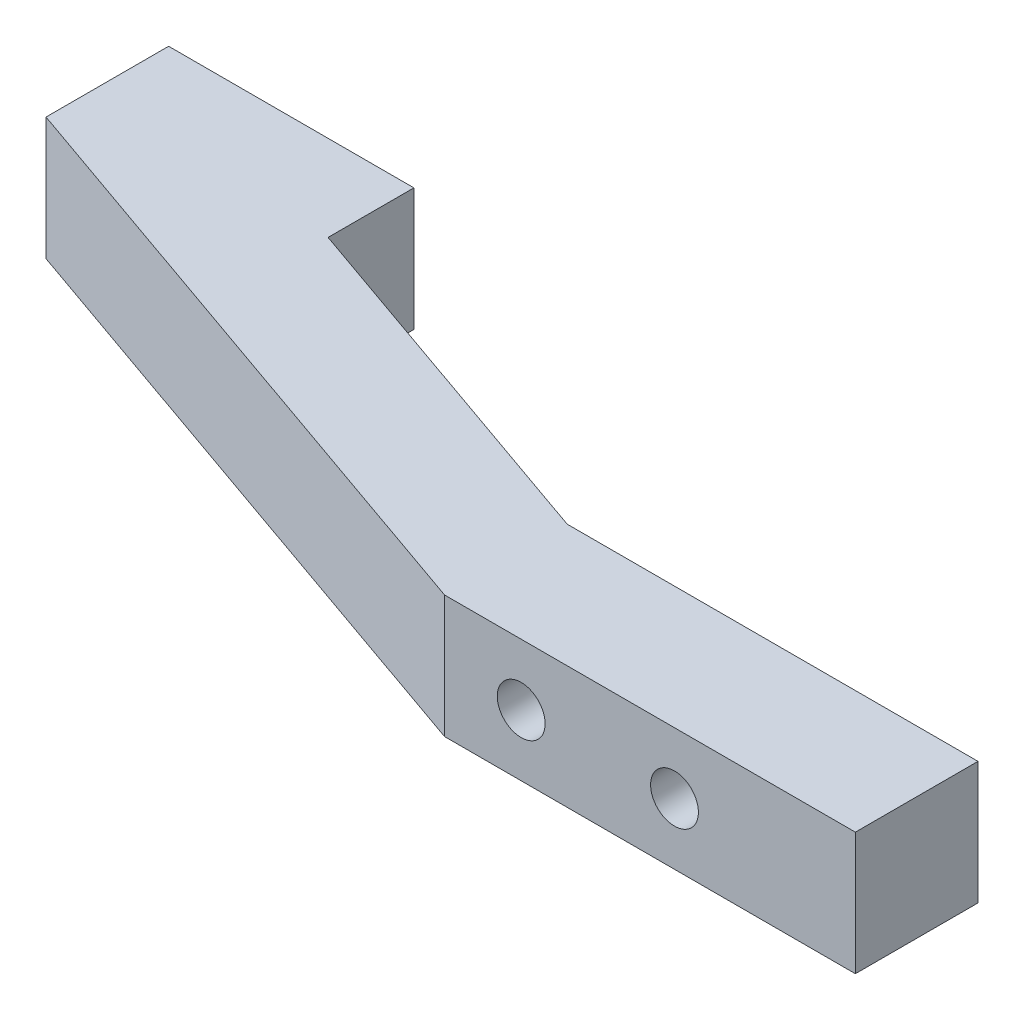
from build123d import *

# Parameters (mm, degrees)
SKETCH3_W           = 13.4
SKETCH3_H           = 4
SKETCH3_R           = 0.78
BOSS_EXTRUDE1_DEPTH = 4
BOSS_EXTRUDE2_DEPTH = 4
SKETCH5_W           = 8
SKETCH5_H           = 4
BOSS_EXTRUDE3_DEPTH = 1


with BuildPart() as part:
    # Sketch3 → Boss-Extrude1 (new body)
    with BuildSketch(Plane.XY):
        with Locations((6.7, 2)):
            Rectangle(SKETCH3_W, SKETCH3_H)
        with Locations((2.5, 2)):
            Circle(SKETCH3_R, mode=Mode.SUBTRACT)
        with Locations((7.5, 2)):
            Circle(SKETCH3_R, mode=Mode.SUBTRACT)
    extrude(amount=BOSS_EXTRUDE1_DEPTH)

    # Sketch4 → Boss-Extrude2 (add)
    with BuildSketch(Plane(origin=(0, 4, 0), x_dir=(1, 0, 0), z_dir=(0, 1, 0))):
        Polygon((0, -4), (-20, 3), (-20, 6), (-12, 6), (-12, 4.2), (0, 0), align=None)
    extrude(amount=-BOSS_EXTRUDE2_DEPTH)

    # Sketch5 → Boss-Extrude3 (add)
    with BuildSketch(Plane(origin=(0, 0, -6), x_dir=(-1, 0, 0), z_dir=(0, 0, -1))):
        with Locations((16, 2)):
            Rectangle(SKETCH5_W, SKETCH5_H)
    extrude(amount=BOSS_EXTRUDE3_DEPTH)


solid = part.part
